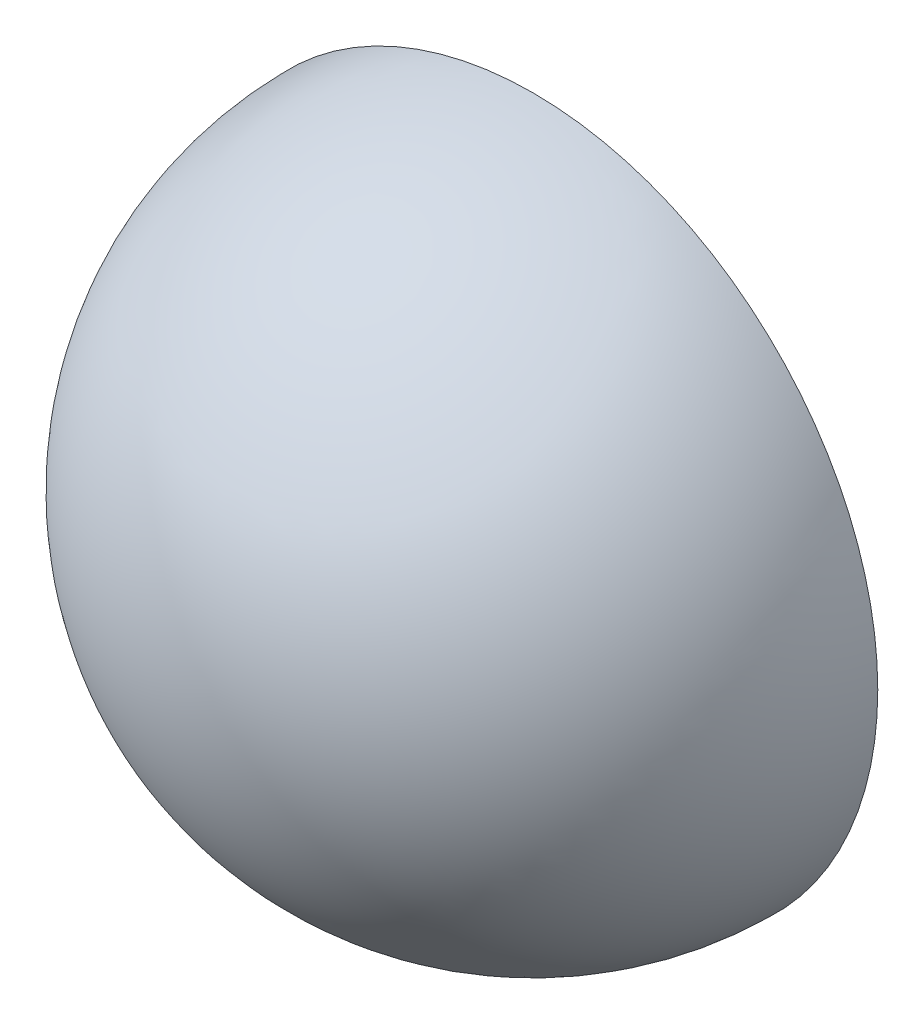
from build123d import *


with BuildPart() as part:
    # Sketch1 → Revolve-Thin1 (revolve)
    with BuildSketch(Plane(origin=(0, 0, 0), x_dir=(0, 0, -1), z_dir=(1, 0, 0))):
        with BuildLine():
            ThreePointArc((0, 21.85), (-15.450283169, 15.450283169), (-21.85, 0))
            Line((-21.85, 0), (-23.85, 0))
            ThreePointArc((-23.85, 0), (-16.864496731, 16.864496731), (0, 23.85))
            Line((0, 23.85), (0, 21.85))
        make_face()
    revolve(axis=Axis((0, 0, 45.57258257), (0, 0, -1)))


solid = part.part
